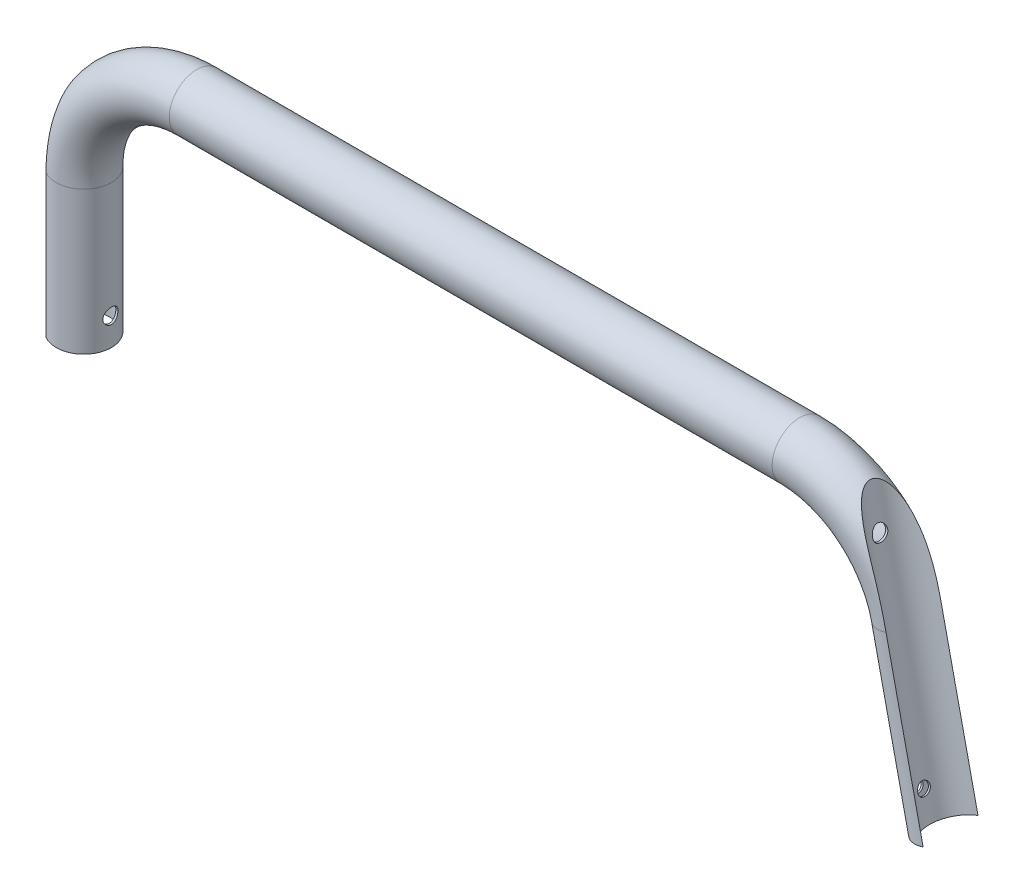
from build123d import *

# Parameters (mm, degrees)
SKETCH2_R               = 11
SKETCH2_R_2             = 10.2
SKETCH3_R               = 11.235817997895355
CUT_EXTRUDE1_DEPTH      = 278.76373678055324
BOSS_EXTRUDE1_REACH     = 279.764
CUT_EXTRUDE2_REACH      = 374.404
CUT_EXTRUDE2_END_RADIUS = 11.000000000000007
SKETCH8_R               = 2.5000000000000004
CUT_EXTRUDE3_REACH      = 408.279
SKETCH9_R               = 3.0000000000000013
CUT_EXTRUDE4_REACH      = 242.893
SKETCH10_R              = 12.69999999999999
BOSS_EXTRUDE2_REACH     = 238.109
SKETCH13_R              = 3.000000000000001
CUT_EXTRUDE5_DEPTH      = 351.092332241762


with BuildPart() as part:
    # Sweep1: sweep along a path in Sketch1
    with BuildLine(Plane.XY) as sweep1_path:
        Line((-201.5133880035479, -101.9), (-201.51338800354787, -45))
        ThreePointArc((-201.51338800354787, -45), (-188.33319315694254, -13.18019484660536), (-156.5133880035479, -6.1e-16))
        Line((-156.5133880035479, -6.1e-16), (83.48661199645207, -1.1102e-13))
        ThreePointArc((83.48661199645207, -1.1102e-13), (111.6531682447347, -9.905198260820335), (127.41993231684906, -35.260217372785355))
        Line((127.41993231684906, -35.260217372785355), (142.19361644498835, -101.90000000000012))
    # Sketch2 → Sweep1 (sweep)
    with BuildSketch(Plane(origin=(-201.5133880035479, -101.9, 0), x_dir=(-1, -5e-16, 0), z_dir=(5e-16, -1, 0))):
        Circle(SKETCH2_R)
        Circle(SKETCH2_R_2, mode=Mode.SUBTRACT)
    sweep(path=sweep1_path.line)

    # Sketch3 → Cut-Extrude1 (cut, through all)
    with BuildSketch(Plane(origin=(28.19361773268533, -127.17319125581994, 0), x_dir=(0.9762960071199333, 0.21643961393810365, 0), z_dir=(0.21643961393810363, -0.9762960071199331, 0))):
        with Locations((120.7678633128925, 0)):
            Circle(SKETCH3_R)
    extrude(amount=-CUT_EXTRUDE1_DEPTH, mode=Mode.SUBTRACT)

    # Sketch6 → Boss-Extrude1 (add, up to next)
    with BuildSketch(Plane(origin=(28.193617732685325, -127.17319125581994, 0), x_dir=(0.9762960071199333, 0.21643961393810365, 0), z_dir=(0.21643961393810365, -0.9762960071199333, 0)), mode=Mode.PRIVATE) as boss_extrude1_sk1:
        with BuildLine():
            ThreePointArc((131.93902491173475, 1.2036422285633261), (109.5320453149972, 4.129e-14), (131.93902491173478, -1.2036422285634136))
            ThreePointArc((131.93902491173478, -1.2036422285634136), (131.2012481553082, -4.826002575972466), (129.61186131215575, -8.163615269443444))
            ThreePointArc((129.61186131215575, -8.163615269443444), (108.73204531499714, 1.47e-15), (129.61186131215575, 8.163615269443444))
            ThreePointArc((129.61186131215575, 8.163615269443444), (131.20124815530818, 4.826002575972403), (131.93902491173475, 1.2036422285633261))
        make_face()
    boss_extrude1_tool1 = extrude(boss_extrude1_sk1.sketch, amount=-BOSS_EXTRUDE1_REACH, mode=Mode.PRIVATE) - part.part
    add(boss_extrude1_tool1.solids().sort_by_distance((134.802876, -103.538488, 0))[0])

    # Cut-Extrude2: up to this cylinder (the profile starts inside it)
    cut_extrude2_end = Plane(origin=(139.72573075969348, -90.76808705327466, 0), z_dir=(0.21643961393810374, -0.9762960071199331, 0)) * Cylinder(CUT_EXTRUDE2_END_RADIUS, 771.808, mode=Mode.PRIVATE)
    # Sketch8 → Cut-Extrude2 (cut, up to the surface)
    with BuildSketch(Plane(origin=(142.19361644498844, -101.90000000000025, 0), x_dir=(0, -1e-17, -1), z_dir=(0.9762960071199333, 0.21643961393810368, 0)), mode=Mode.PRIVATE) as cut_extrude2_sk1:
        with Locations(Location((0, 11.40218999047264, 0), (0, 0, 90))):
            Circle(SKETCH8_R)
    cut_extrude2_tool1 = extrude(cut_extrude2_sk1.sketch, amount=-CUT_EXTRUDE2_REACH, mode=Mode.PRIVATE) & cut_extrude2_end
    add(cut_extrude2_tool1.solids().sort_by_distance((139.725731, -90.768087, 0))[0], mode=Mode.SUBTRACT)

    # Sketch9 → Cut-Extrude3 (cut, up to next)
    with BuildSketch(Plane(origin=(180, 0, 0), x_dir=(0, 0, -1), z_dir=(1, 0, 0)), mode=Mode.PRIVATE) as cut_extrude3_sk1:
        with Locations((0, -12.919035994652349)):
            Circle(SKETCH9_R)
    cut_extrude3_tool1 = extrude(cut_extrude3_sk1.sketch, amount=-CUT_EXTRUDE3_REACH, mode=Mode.PRIVATE) & part.part
    add(cut_extrude3_tool1.solids().sort_by_distance((180, -12.919036, 0))[0], mode=Mode.SUBTRACT)

    # Sketch10 → Cut-Extrude4 (cut, up to next)
    with BuildSketch(Plane.XZ.offset(101.8999999999999), mode=Mode.PRIVATE) as cut_extrude4_sk1:
        with Locations((-215.513388003548, -6.61e-15)):
            Circle(SKETCH10_R)
    cut_extrude4_tool1 = extrude(cut_extrude4_sk1.sketch, amount=-CUT_EXTRUDE4_REACH, mode=Mode.PRIVATE) & part.part
    add(cut_extrude4_tool1.solids().sort_by_distance((-215.513388, -101.9, 0))[0], mode=Mode.SUBTRACT)

    # Sketch11 → Boss-Extrude2 (add, up to next)
    with BuildSketch(Plane.XZ.offset(101.8999999999999), mode=Mode.PRIVATE) as boss_extrude2_sk1:
        with BuildLine():
            ThreePointArc((-207.07445943211945, 9.490757849946776), (-202.81338800354803, -6.94e-15), (-207.07445943211945, -9.49075784994679))
            ThreePointArc((-207.07445943211945, -9.49075784994679), (-206.6089925442244, -9.748580120460542), (-206.1316022892623, -9.98359137841811))
            ThreePointArc((-206.1316022892623, -9.98359137841811), (-201.81338800354803, -3.9e-15), (-206.1316022892623, 9.983591378418105))
            ThreePointArc((-206.1316022892623, 9.983591378418105), (-206.6089925442244, 9.748580120460524), (-207.07445943211945, 9.490757849946776))
        make_face()
    boss_extrude2_tool1 = extrude(boss_extrude2_sk1.sketch, amount=-BOSS_EXTRUDE2_REACH, mode=Mode.PRIVATE) - part.part
    add(boss_extrude2_tool1.solids().sort_by_distance((-202.606901, -101.9, 0))[0])

    # Sketch13 → Cut-Extrude5 (cut, through all)
    with BuildSketch(Plane(origin=(-190.51338800354793, 0, 0), x_dir=(0, 0, -1), z_dir=(1, 0, 0))):
        with Locations((0, -90.9)):
            Circle(SKETCH13_R)
    extrude(amount=-CUT_EXTRUDE5_DEPTH, mode=Mode.SUBTRACT)


solid = part.part
